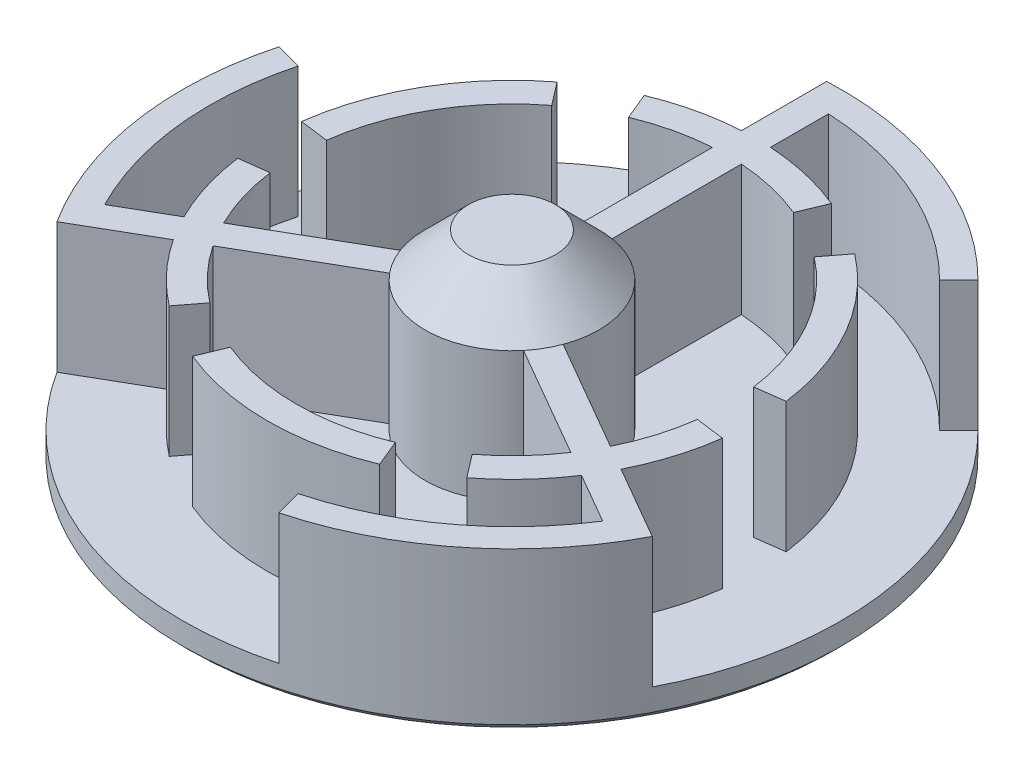
from build123d import *

# Parameters (mm, degrees)
SKETCH1_R           = 36.11499
BOSS_EXTRUDE1_DEPTH = 3.175
SKETCH2_R           = 9.525
BOSS_EXTRUDE3_DEPTH = 19.05
CHAMFER1_SIZE       = 4.7625
SKETCH5_R           = 15.875
BOSS_EXTRUDE4_DEPTH = 11.90625
BOSS_EXTRUDE5_DEPTH = 14.2875
CIRPATTERN1_COUNT   = 3
BOSS_EXTRUDE6_DEPTH = 14.2875
CIRPATTERN2_COUNT   = 6
SKETCH9_R           = 13.335
CUT_EXTRUDE1_DEPTH  = 11.90625
CHAMFER2_SIZE       = 0.762
CHAMFER3_SIZE       = 0.762


with BuildPart() as part:
    # Sketch1 → Boss-Extrude1 (new body)
    with BuildSketch(Plane(origin=(0, 0, 0), x_dir=(1, 0, 0), z_dir=(0, 1, 0))):
        with Locations(Location((0, 0, 0), (0, 0, 270))):
            Circle(SKETCH1_R)
    extrude(amount=BOSS_EXTRUDE1_DEPTH)

    # Sketch2 → Boss-Extrude3 (add)
    with BuildSketch(Plane(origin=(0, 3.175, 0), x_dir=(1, 0, 0), z_dir=(0, 1, 0))):
        with Locations(Location((0, 0, 0), (0, 0, 90))):
            Circle(SKETCH2_R)
    extrude(amount=BOSS_EXTRUDE3_DEPTH)

    # Chamfer1
    chamfer1_edges = [part.edges().sort_by_distance(p)[0] for p in [
        (0, 22.225, 9.525),
    ]]
    chamfer(chamfer1_edges, length=CHAMFER1_SIZE)

    # Sketch5 → Boss-Extrude4 (add)
    with BuildSketch(Plane.XZ):
        with Locations(Location((0, 0, 0), (0, 0, 270))):
            Circle(SKETCH5_R)
    extrude(amount=BOSS_EXTRUDE4_DEPTH)

    # Sketch6 → Boss-Extrude5 (add)
    with BuildSketch(Plane(origin=(0, 3.175, 0), x_dir=(1, 0, 0), z_dir=(0, 1, 0))):
        with BuildLine():
            Line((-1.5875, 36.080082406), (-1.5875, 9.391776656))
            ThreePointArc((-1.5875, 9.391776656), (0, 9.525), (1.5875, 9.391776656))
            Line((1.5875, 9.391776656), (1.5875, 33.101016708))
            ThreePointArc((1.5875, 33.101016708), (13.411669734, 30.303870682), (23.432855816, 23.432855816))
            Line((23.432855816, 23.432855816), (25.537154331, 25.537154331))
            ThreePointArc((25.537154331, 25.537154331), (13.083761644, 33.661664902), (-1.5875, 36.080082406))
        make_face()
    boss_extrude5 = extrude(amount=BOSS_EXTRUDE5_DEPTH)

    # CirPattern1: Boss-Extrude5 ×3 about axis
    cirpattern1_axis = Axis((0, 22.225, 0), (0, -1, 0))
    for i in range(1, CIRPATTERN1_COUNT):
        add(boss_extrude5.rotate(cirpattern1_axis, i * 360 / CIRPATTERN1_COUNT))

    # Sketch8 → Boss-Extrude6 (add)
    with BuildSketch(Plane(origin=(0, 3.175, 0), x_dir=(1, 0, 0), z_dir=(0, 1, 0))):
        with BuildLine():
            ThreePointArc((14.375330432, 18.734295362), (20.450378012, 11.80703125), (23.412040922, 3.082253661))
            Line((23.412040922, 3.082253661), (26.559878357, 3.496674321))
            ThreePointArc((26.559878357, 3.496674321), (23.200008669, 13.39453125), (16.308147969, 21.253192218))
            Line((16.308147969, 21.253192218), (14.375330432, 18.734295362))
        make_face()
    boss_extrude6 = extrude(amount=BOSS_EXTRUDE6_DEPTH)

    # CirPattern2: Boss-Extrude6 ×6 about axis
    cirpattern2_axis = Axis((0, 0, 0), (0, 1, 0))
    for i in range(1, CIRPATTERN2_COUNT):
        add(boss_extrude6.rotate(cirpattern2_axis, i * 360 / CIRPATTERN2_COUNT))

    # Sketch9 → Cut-Extrude1 (cut)
    with BuildSketch(Plane.XZ.offset(11.90625)):
        with Locations(Location((0, 0, 0), (0, 0, 270))):
            Circle(SKETCH9_R)
    extrude(amount=-CUT_EXTRUDE1_DEPTH, mode=Mode.SUBTRACT)

    # Chamfer2
    chamfer2_edges = [part.edges().sort_by_distance(p)[0] for p in [
        (0, 0, -36.11499),
    ]]
    chamfer(chamfer2_edges, length=CHAMFER2_SIZE)

    # Chamfer3
    chamfer3_edges = [part.edges().sort_by_distance(p)[0] for p in [
        (0, -11.90625, 15.875),
    ]]
    chamfer(chamfer3_edges, length=CHAMFER3_SIZE)


solid = part.part
